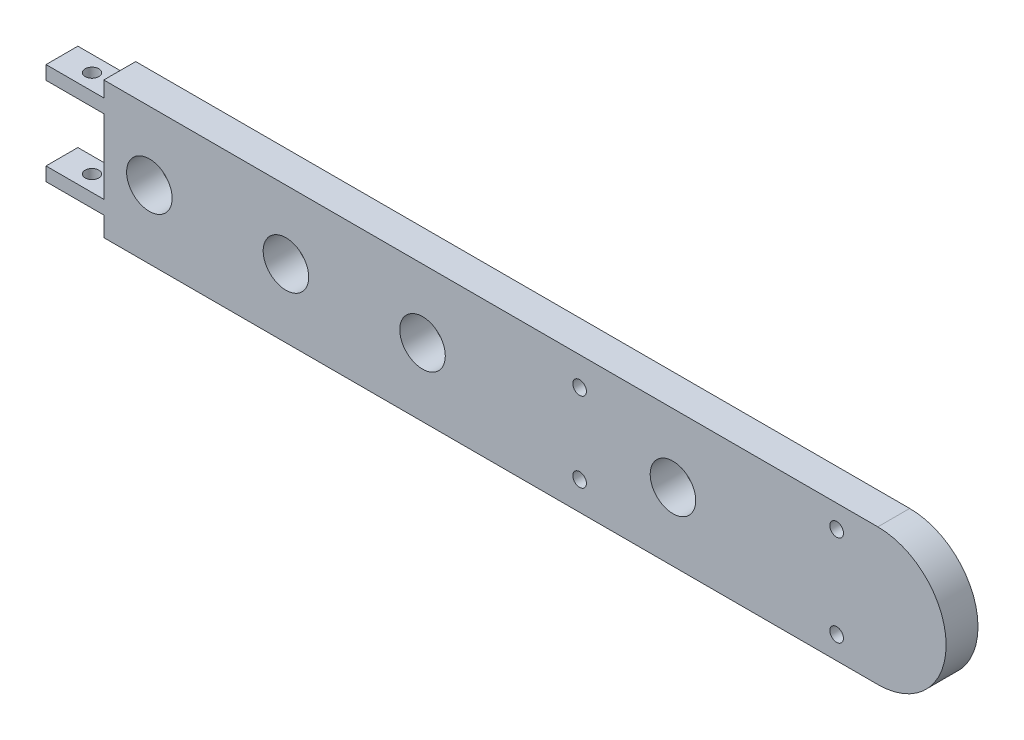
from build123d import *

# Parameters (mm, degrees)
BOSS_EXTRUDE1_DEPTH      = 7
SKETCH2_R                = 5
CUT_EXTRUDE1_DEPTH       = 7
LPATTERN1_COUNT          = 7
LPATTERN1_PITCH          = 30
SKETCH6_R                = 5
CUT_EXTRUDE2_DEPTH       = 10
CUT_EXTRUDE4_REACH       = 219.196
SKETCH9_R                = 1.5
SKETCH16_W               = 47
SKETCH16_H               = 39.930416712
SKETCH16_R               = 8.2
BOSS_EXTRUDE2_DEPTH      = 10
SKETCH17_W               = 45.833760325
SKETCH17_H               = 30.12512517
SKETCH17_W_2             = 13.763297709
SKETCH17_H_2             = 9.222578979
CUT_EXTRUDE15_DEPTH      = 9
CUT_EXTRUDE18_REACH      = 223.779
SKETCH18_W               = 140
SKETCH18_H               = 115.832892108
BOSS_EXTRUDE5_START      = -7
BOSS_EXTRUDE5_DEPTH      = 7
CUT_EXTRUDE19_DEPTH      = 10
SKETCH25_W               = 7
SKETCH25_H               = 3
BOSS_EXTRUDE6_DEPTH      = 12.7
CUT_EXTRUDE20_DEPTH      = 114.382079461
CUT_EXTRUDE20_DEPTH_BACK = 114.382079461
SKETCH26_R               = 1.5


with BuildPart() as part:
    # Sketch1 → Boss-Extrude1 (new body)
    with BuildSketch(Plane.XY):
        with BuildLine():
            Line((-200, 0), (50, 0))
            ThreePointArc((50, 0), (65, -15), (50, -30))
            Line((50, -30), (-200, -30))
            ThreePointArc((-200, -30), (-215, -15), (-200, 0))
        make_face()
    extrude(amount=BOSS_EXTRUDE1_DEPTH)

    # Sketch2 → Cut-Extrude1 (cut)
    with BuildSketch(Plane.XY.offset(7)):
        with Locations((-185, -15)):
            Circle(SKETCH2_R)
    cut_extrude1 = extrude(amount=-CUT_EXTRUDE1_DEPTH, mode=Mode.SUBTRACT)

    # LPattern1: Cut-Extrude1 ×7
    with Locations(*[(i * LPATTERN1_PITCH, 0, 0) for i in range(1, LPATTERN1_COUNT)]):
        add(cut_extrude1, mode=Mode.SUBTRACT)

    # Sketch6 → Cut-Extrude2 (cut)
    with BuildSketch(Plane(origin=(0, 0, 0), x_dir=(-1, 0, 0), z_dir=(0, 0, -1))):
        with Locations((-50, -15)):
            Circle(SKETCH6_R)
    extrude(amount=-CUT_EXTRUDE2_DEPTH, mode=Mode.SUBTRACT)

    # Sketch9 → Cut-Extrude4 (cut, up to next)
    with BuildSketch(Plane(origin=(0, 0, 0), x_dir=(-1, 0, 0), z_dir=(0, 0, -1)), mode=Mode.PRIVATE) as cut_extrude4_sk1:
        with Locations((-29.5, -6.25)):
            Circle(SKETCH9_R)
    cut_extrude4_tool1 = extrude(cut_extrude4_sk1.sketch, amount=-CUT_EXTRUDE4_REACH, mode=Mode.PRIVATE) & part.part
    # Sketch9 → Cut-Extrude4 (cut, up to next)
    with BuildSketch(Plane(origin=(0, 0, 0), x_dir=(-1, 0, 0), z_dir=(0, 0, -1)), mode=Mode.PRIVATE) as cut_extrude4_sk2:
        with Locations((-29.5, -23.75)):
            Circle(SKETCH9_R)
    cut_extrude4_tool2 = extrude(cut_extrude4_sk2.sketch, amount=-CUT_EXTRUDE4_REACH, mode=Mode.PRIVATE) & part.part
    add(cut_extrude4_tool1.solids().sort_by_distance((29.5, -6.25, 0))[0], mode=Mode.SUBTRACT)
    add(cut_extrude4_tool2.solids().sort_by_distance((29.5, -23.75, 0))[0], mode=Mode.SUBTRACT)

    # Sketch16 → Boss-Extrude2 (add)
    with BuildSketch(Plane(origin=(0, 0, 0), x_dir=(-1, 0, 0), z_dir=(0, 0, -1))):
        with Locations((156.5, -31.726084321)):
            Rectangle(SKETCH16_W, SKETCH16_H)
        with Locations((143.645834005, -39.243444981)):
            Circle(SKETCH16_R, mode=Mode.SUBTRACT)
        with Locations((169.806394215, -39.243444981)):
            Circle(SKETCH16_R, mode=Mode.SUBTRACT)
        with BuildLine():
            Line((152.543612389, -45.175236858), (161.148055619, -45.175236858))
            ThreePointArc((161.148055619, -45.175236858), (162.890378664, -46.917559902), (161.148055619, -48.659882947))
            Line((161.148055619, -48.659882947), (152.543612389, -48.659882947))
            ThreePointArc((152.543612389, -48.659882947), (150.801289344, -46.917559902), (152.543612389, -45.175236858))
        make_face(mode=Mode.SUBTRACT)
    extrude(amount=BOSS_EXTRUDE2_DEPTH)

    # Sketch17 → Cut-Extrude15 (cut)
    with BuildSketch(Plane(origin=(0, 0, -10), x_dir=(-1, 0, 0), z_dir=(0, 0, -1))):
        with Locations((156.666880163, -35.963336462)):
            Rectangle(SKETCH17_W, SKETCH17_H)
        with Locations((156.826506841, -16.372165454)):
            Rectangle(SKETCH17_W_2, SKETCH17_H_2)
    extrude(amount=-CUT_EXTRUDE15_DEPTH, mode=Mode.SUBTRACT)

    # Sketch18 → Cut-Extrude18 (cut, up to next)
    with BuildSketch(Plane.XY.offset(7), mode=Mode.PRIVATE) as cut_extrude18_sk1:
        with Locations((-145, -15)):
            Rectangle(SKETCH18_W, SKETCH18_H)
    cut_extrude18_tool1 = extrude(cut_extrude18_sk1.sketch, amount=-CUT_EXTRUDE18_REACH, mode=Mode.PRIVATE) & part.part
    add(cut_extrude18_tool1.solids().sort_by_distance((-145, -15, 7))[0], mode=Mode.SUBTRACT)

    # Sketch23 → Boss-Extrude5 (add)
    with BuildSketch(Plane.XY.offset(7).offset(BOSS_EXTRUDE5_START)):
        with BuildLine():
            Line((95, 0), (50, 0))
            ThreePointArc((50, 0), (65, -15), (50, -30))
            Line((50, -30), (95, -30))
            ThreePointArc((95, -30), (110, -15), (95, 0))
        make_face()
    extrude(amount=BOSS_EXTRUDE5_DEPTH)

    # Sketch24 → Cut-Extrude19 (cut)
    with BuildSketch(Plane.XY.offset(7)):
        with BuildLine():
            ThreePointArc((87.45, -25), (87.010660172, -23.939339828), (85.95, -23.5))
            Line((85.95, -23.5), (85.95, -26.5))
            ThreePointArc((85.95, -26.5), (87.010660172, -26.060660172), (87.45, -25))
        make_face()
        with BuildLine():
            Line((85.95, -26.5), (85.95, -23.5))
            ThreePointArc((85.95, -23.5), (84.45, -25), (85.95, -26.5))
        make_face()
        with BuildLine():
            ThreePointArc((87.45, -5), (87.010660172, -3.939339828), (85.95, -3.5))
            Line((85.95, -3.5), (85.95, -6.5))
            ThreePointArc((85.95, -6.5), (87.010660172, -6.060660172), (87.45, -5))
        make_face()
        with BuildLine():
            Line((85.95, -6.5), (85.95, -3.5))
            ThreePointArc((85.95, -3.5), (84.45, -5), (85.95, -6.5))
        make_face()
    extrude(amount=-CUT_EXTRUDE19_DEPTH, mode=Mode.SUBTRACT)

    # Sketch25 → Boss-Extrude6 (add)
    with BuildSketch(Plane.ZY.offset(75)):
        with Locations((3.5, -4.920008597)):
            Rectangle(SKETCH25_W, SKETCH25_H)
        with Locations((3.5, -24.2)):
            Rectangle(SKETCH25_W, SKETCH25_H)
    extrude(amount=BOSS_EXTRUDE6_DEPTH)

    # Sketch26 → Cut-Extrude20 (cut, two sides: drawn at the far end of the back side and taken through both)
    with BuildSketch(Plane(origin=(0, -3.420008597, 0), x_dir=(1, 0, 0), z_dir=(0, 1, 0)).offset(-CUT_EXTRUDE20_DEPTH_BACK)):
        with Locations(Location((-81.1, -3.5, 0), (0, 0, 180))):
            Circle(SKETCH26_R)
    extrude(amount=CUT_EXTRUDE20_DEPTH + CUT_EXTRUDE20_DEPTH_BACK, mode=Mode.SUBTRACT)


solid = part.part
